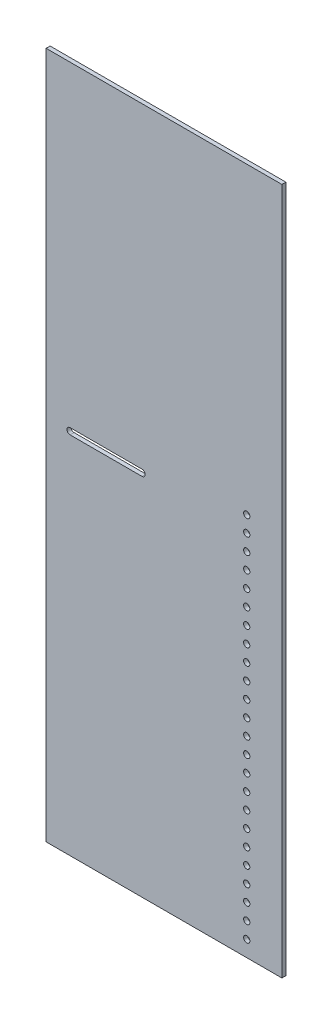
from build123d import *

# Parameters (mm, degrees)
SKETCH1_W                  = 546.1
SKETCH1_H                  = 187.325
BOSS_EXTRUDE1_DEPTH        = 3.175
CUT_EXTRUDE1_DEPTH         = 289.68503084
F_9_0_196_DIAMETER_HOLE1_D = 4.9784


with BuildPart() as part:
    # Sketch1 → Boss-Extrude1 (new body)
    with BuildSketch(Plane(origin=(0, 0, 0), x_dir=(0, 1, 0), z_dir=(0, 0, 1))):
        Rectangle(SKETCH1_W, SKETCH1_H)
    extrude(amount=BOSS_EXTRUDE1_DEPTH)

    # Sketch2 → Cut-Extrude1 (cut, through all)
    with BuildSketch(Plane.XY.offset(3.175)):
        with BuildLine():
            Line((-74.6125, 16.5608), (-17.4625, 16.5608))
            ThreePointArc((-17.4625, 16.5608), (-14.9733, 19.05), (-17.4625, 21.5392))
            Line((-17.4625, 21.5392), (-74.6125, 21.5392))
            ThreePointArc((-74.6125, 21.5392), (-77.1017, 19.05), (-74.6125, 16.5608))
        make_face()
    extrude(amount=-CUT_EXTRUDE1_DEPTH, mode=Mode.SUBTRACT)

    # #9 (0.196) Diameter Hole1 (through all)
    with Locations(Plane.XY.offset(3.175)):
        with Locations((65.7225, -260.35), (65.7225, -247.65), (65.7225, -234.95), (65.7225, -222.25), (65.7225, -209.55), (65.7225, -196.85), (65.7225, -184.15), (65.7225, -171.45), (65.7225, -158.75), (65.7225, -146.05), (65.7225, -133.35), (65.7225, -120.65), (65.7225, -107.95), (65.7225, -95.25), (65.7225, -82.55), (65.7225, -69.85), (65.7225, -57.15), (65.7225, -44.45), (65.7225, -31.75), (65.7225, -19.05), (65.7225, -6.35), (65.7225, 6.35), (65.7225, 19.05), (65.7225, 31.75)):
            Hole(F_9_0_196_DIAMETER_HOLE1_D / 2)


solid = part.part
